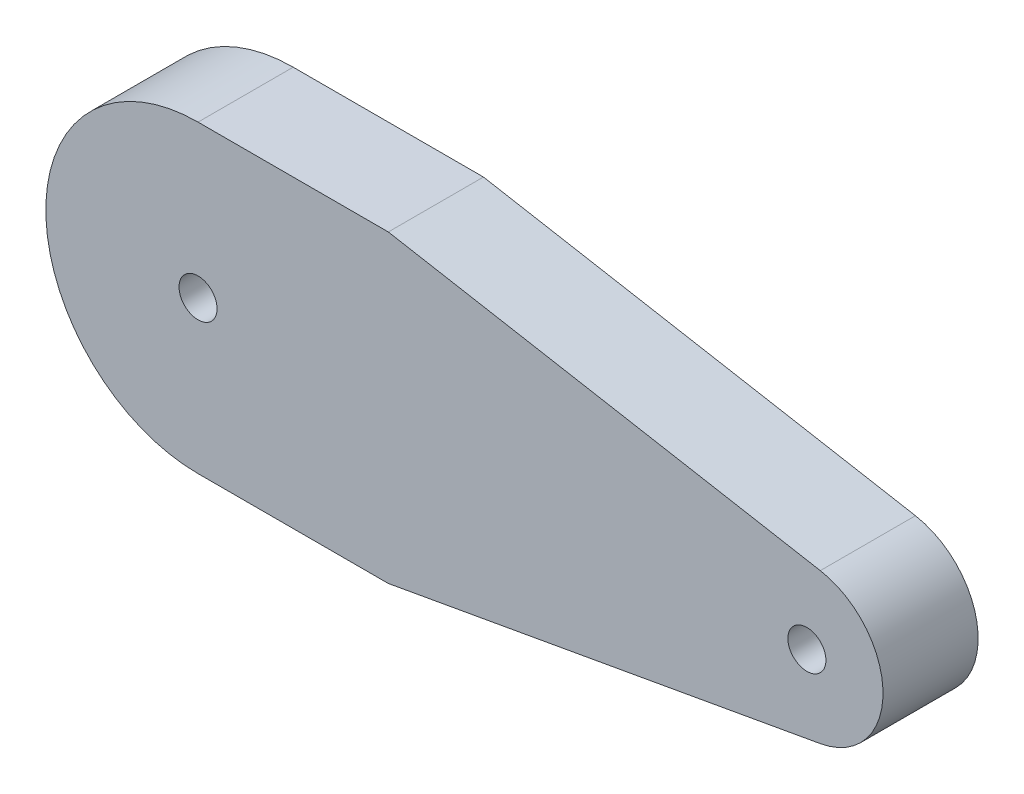
from build123d import *

# Parameters (mm, degrees)
BOSS_EXTRUDE1_DEPTH = 50
SKETCH2_R           = 10
CUT_EXTRUDE1_DEPTH  = 20


with BuildPart() as part:
    # Sketch1 → Boss-Extrude1 (new body)
    with BuildSketch(Plane.XY):
        with BuildLine():
            Line((0, 80), (100, 80))
            Line((100, 80), (327.045328578, 39.374653589))
            ThreePointArc((327.045328578, 39.374653589), (360, 0), (327.045328578, -39.374653589))
            Line((327.045328578, -39.374653589), (100, -80))
            Line((100, -80), (0, -80))
            ThreePointArc((0, -80), (-80, 0), (0, 80))
        make_face()
    extrude(amount=BOSS_EXTRUDE1_DEPTH)

    # Sketch2 → Cut-Extrude1 (cut)
    with BuildSketch(Plane.XY.offset(50)):
        Circle(SKETCH2_R)
        with Locations((320, 0)):
            Circle(SKETCH2_R)
    extrude(amount=-CUT_EXTRUDE1_DEPTH, mode=Mode.SUBTRACT)


solid = part.part
